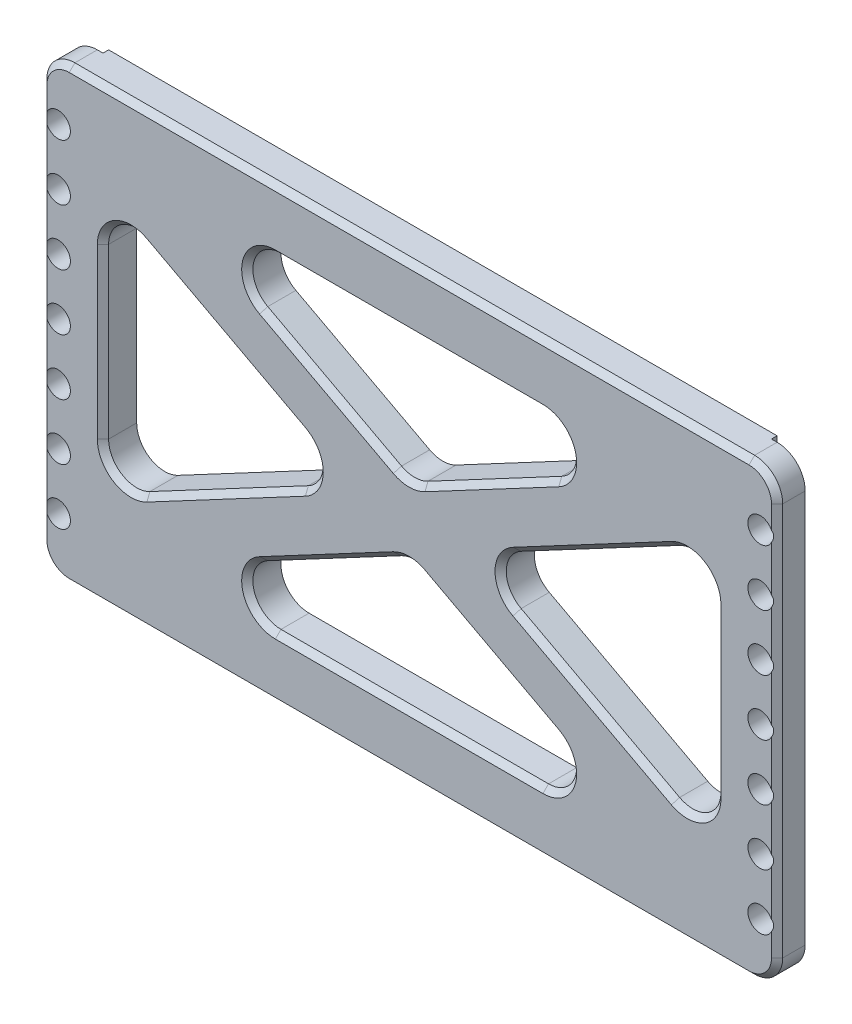
from build123d import *

# Parameters (mm, degrees)
SKETCH_3_W          = 131
SKETCH_3_H          = 80
EXTRUDE_3_DEPTH     = 5
SKETCH_4_W          = 119
SKETCH_4_H          = 80
EXTRUDE_4_DEPTH     = 6
FILLET_2_R          = 5
CHAMFER_1_SIZE      = 1
CUT_EXTRUDE_1_DEPTH = 6
FILLET_3_R          = 5
CHAMFER_2_SIZE      = 1
SKETCH_6_R          = 2.2
CUT_EXTRUDE_2_DEPTH = 11


with BuildPart() as part:
    # 草图3 → 凸台-拉伸3 (new body)
    with BuildSketch(Plane.XY):
        with Locations((0, -51.5)):
            Rectangle(SKETCH_3_W, SKETCH_3_H)
    extrude(amount=EXTRUDE_3_DEPTH)

    # 草图4 → 凸台-拉伸4 (add)
    with BuildSketch(Plane.XY.offset(5)):
        with Locations((0, -51.5)):
            Rectangle(SKETCH_4_W, SKETCH_4_H)
    extrude(amount=-EXTRUDE_4_DEPTH)

    # 圆角2
    fillet_2_edges = [part.edges().sort_by_distance(p)[0] for p in [
        (-65.5, -11.5, 2.5),
        (65.5, -11.5, 2.5),
        (65.5, -91.5, 2.5),
        (-65.5, -91.5, 2.5),
    ]]
    fillet(fillet_2_edges, radius=FILLET_2_R)

    # 倒角1
    chamfer_1_edges = [part.edges().sort_by_distance(p)[0] for p in [
        (0, -11.5, 5),
        (65.5, -51.5, 5),
        (0, -91.5, 5),
        (-65.5, -51.5, 5),
        (64.035533906, -90.035533906, 5),
        (-64.035533906, -90.035533906, 5),
        (-64.035533906, -12.964466094, 5),
        (64.035533906, -12.964466094, 5),
    ]]
    chamfer(chamfer_1_edges, length=CHAMFER_1_SIZE)

    # 草图5 → 切除-拉伸1 (cut)
    with BuildSketch(Plane.XY.offset(5)):
        Polygon((-10.644021059, -51.5), (-54.5, -28.163791023), (-54.5, -74.836208978), align=None)
        Polygon((43.855978941, -22.5), (-43.855978941, -22.5), (0, -45.836208978), align=None)
        Polygon((54.5, -28.163791023), (10.644021059, -51.5), (54.5, -74.836208978), align=None)
        Polygon((43.855978941, -80.5), (0, -57.163791023), (-43.855978941, -80.5), align=None)
    extrude(amount=-CUT_EXTRUDE_1_DEPTH, mode=Mode.SUBTRACT)

    # 圆角3
    fillet_3_edges = [part.edges().sort_by_distance(p)[0] for p in [
        (10.644021059, -51.5, 2),
        (54.5, -28.163791023, 2),
        (54.5, -74.836208978, 2),
        (-43.855978941, -22.5, 2),
        (43.855978941, -22.5, 2),
        (0, -45.836208978, 2),
        (-43.855978941, -80.5, 2),
        (0, -57.163791023, 2),
        (43.855978941, -80.5, 2),
        (-54.5, -74.836208978, 2),
        (-54.5, -28.163791023, 2),
        (-10.644021059, -51.5, 2),
    ]]
    fillet(fillet_3_edges, radius=FILLET_3_R)

    # 倒角2
    chamfer_2_edges = [part.edges().sort_by_distance(p)[0] for p in [
        (33.045284631, -39.580061586, 5),
        (54.5, -51.5, 5),
        (33.045284631, -63.419938415, 5),
        (14.256439507, -38.250213644, 5),
        (-14.256439507, -38.250213644, 5),
        (0, -22.5, 5),
        (-33.045284631, -39.580061586, 5),
        (-33.045284631, -63.419938415, 5),
        (-54.5, -51.5, 5),
        (-14.256439507, -64.749786356, 5),
        (14.256439507, -64.749786356, 5),
        (0, -80.5, 5),
        (52.074521107, -32.201893935, 5),
        (52.074521107, -70.798106066, 5),
        (16.288042118, -51.5, 5),
        (0, -45.172417956, 5),
        (-28.666695849, -26.289632976, 5),
        (28.666695849, -26.289632976, 5),
        (-16.288042118, -51.5, 5),
        (-52.074521107, -70.798106066, 5),
        (-52.074521107, -32.201893935, 5),
        (0, -57.827582045, 5),
        (28.666695849, -76.710367025, 5),
        (-28.666695849, -76.710367025, 5),
    ]]
    chamfer(chamfer_2_edges, length=CHAMFER_2_SIZE)

    # 草图6 → 切除-拉伸2 (cut)
    with BuildSketch(Plane.XY.offset(5)):
        with Locations(Location((62.5, -21.5, 0), (0, 0, 24.619977329))):
            Circle(SKETCH_6_R)
        with Locations(Location((62.5, -31.5, 0), (0, 0, 24.619977329))):
            Circle(SKETCH_6_R)
        with Locations(Location((62.5, -41.5, 0), (0, 0, 24.619977329))):
            Circle(SKETCH_6_R)
        with Locations(Location((62.5, -51.5, 0), (0, 0, 24.619977329))):
            Circle(SKETCH_6_R)
        with Locations(Location((62.5, -61.5, 0), (0, 0, 24.619977329))):
            Circle(SKETCH_6_R)
        with Locations(Location((62.5, -71.5, 0), (0, 0, 24.619977329))):
            Circle(SKETCH_6_R)
        with Locations(Location((62.5, -81.5, 0), (0, 0, 335.380022671))):
            Circle(SKETCH_6_R)
    cut_extrude_2 = extrude(amount=-CUT_EXTRUDE_2_DEPTH, mode=Mode.SUBTRACT)

    # 镜向1: 切除-拉伸2 across plane
    add(cut_extrude_2.mirror(Plane(origin=(0, 0, 0), x_dir=(0, 0, 1), z_dir=(1, 0, 0))), mode=Mode.SUBTRACT)


solid = part.part
